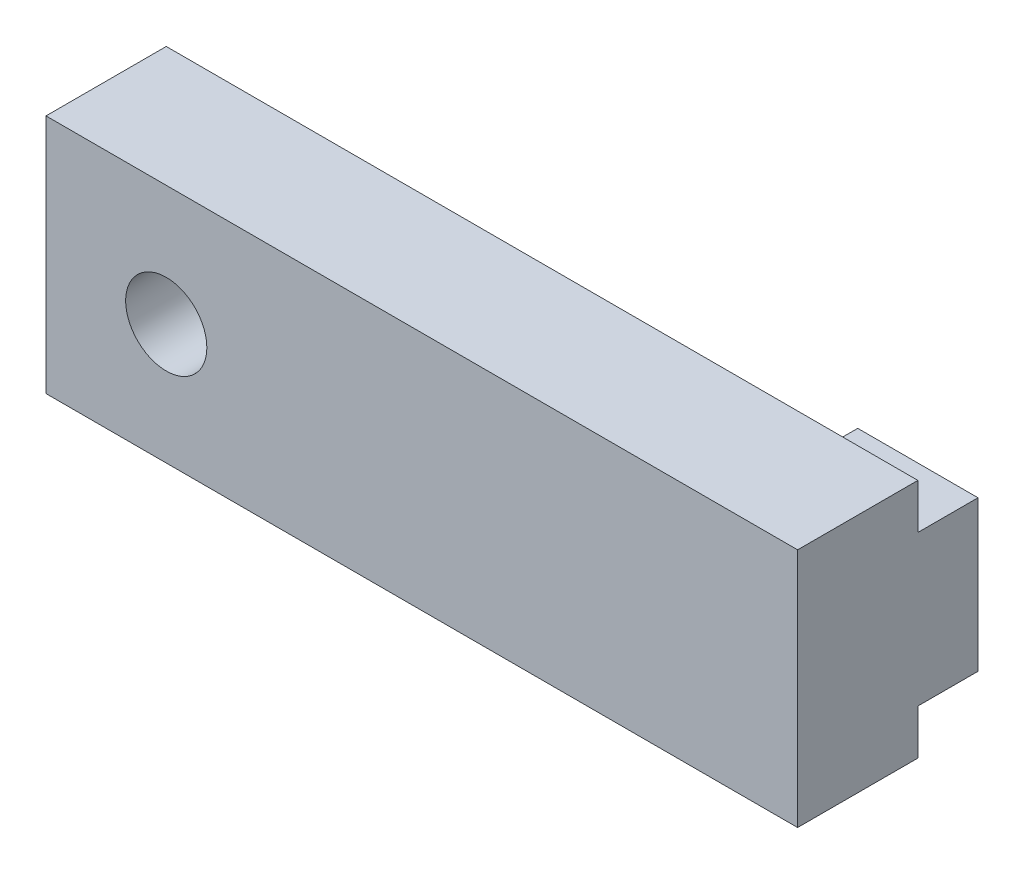
from build123d import *

# Parameters (mm, degrees)
SKETCH2_W                  = 50
SKETCH2_H                  = 16
CLAMP_ARM_DEPTH            = 8
SKETCH3_R                  = 2.7
PIVOT_BOLT_CLEARANCE_DEPTH = 8
CONTACT_NOSE_START         = -4
SKETCH4_W                  = 8
SKETCH4_H                  = 10
CONTACT_NOSE_DEPTH         = 4


with BuildPart() as part:
    # Sketch2 → Clamp_arm (new body)
    with BuildSketch(Plane.XY):
        with Locations((17, 0)):
            Rectangle(SKETCH2_W, SKETCH2_H)
    extrude(amount=CLAMP_ARM_DEPTH)

    # Sketch3 → Pivot_bolt_clearance (cut)
    with BuildSketch(Plane.XY):
        Circle(SKETCH3_R)
    extrude(amount=PIVOT_BOLT_CLEARANCE_DEPTH, mode=Mode.SUBTRACT)

    # Sketch4 → Contact_nose (add)
    with BuildSketch(Plane.XY.offset(CONTACT_NOSE_START)):
        with Locations((38, 0)):
            Rectangle(SKETCH4_W, SKETCH4_H)
    extrude(amount=CONTACT_NOSE_DEPTH)


solid = part.part
